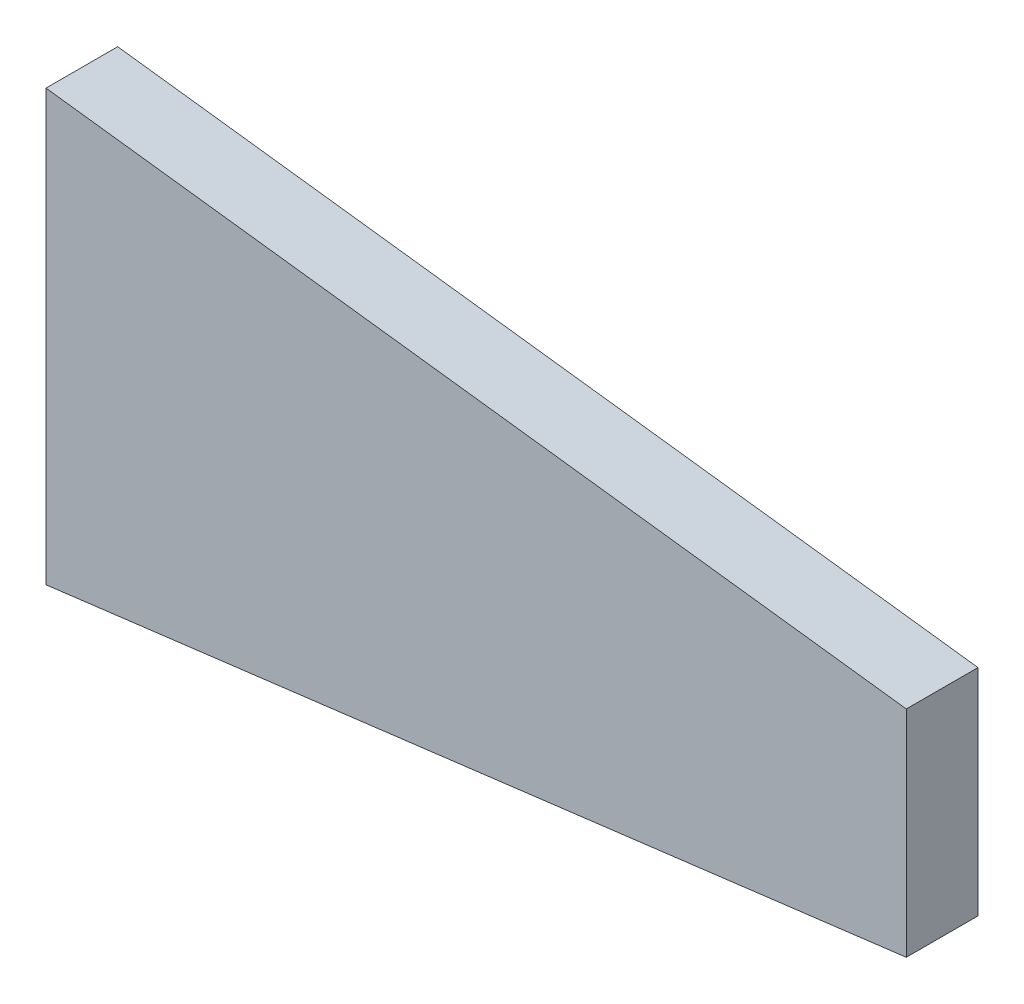
from build123d import *

# Parameters (mm, degrees)
BOSS_EXTRUDE1_DEPTH = 12.7


with BuildPart() as part:
    # Sketch1 → Boss-Extrude1 (new body)
    with BuildSketch(Plane.XY):
        Polygon((-76.2, 38.1), (76.2, 19.05), (76.2, -19.05), (-76.2, -38.1), align=None)
    extrude(amount=BOSS_EXTRUDE1_DEPTH)


solid = part.part
